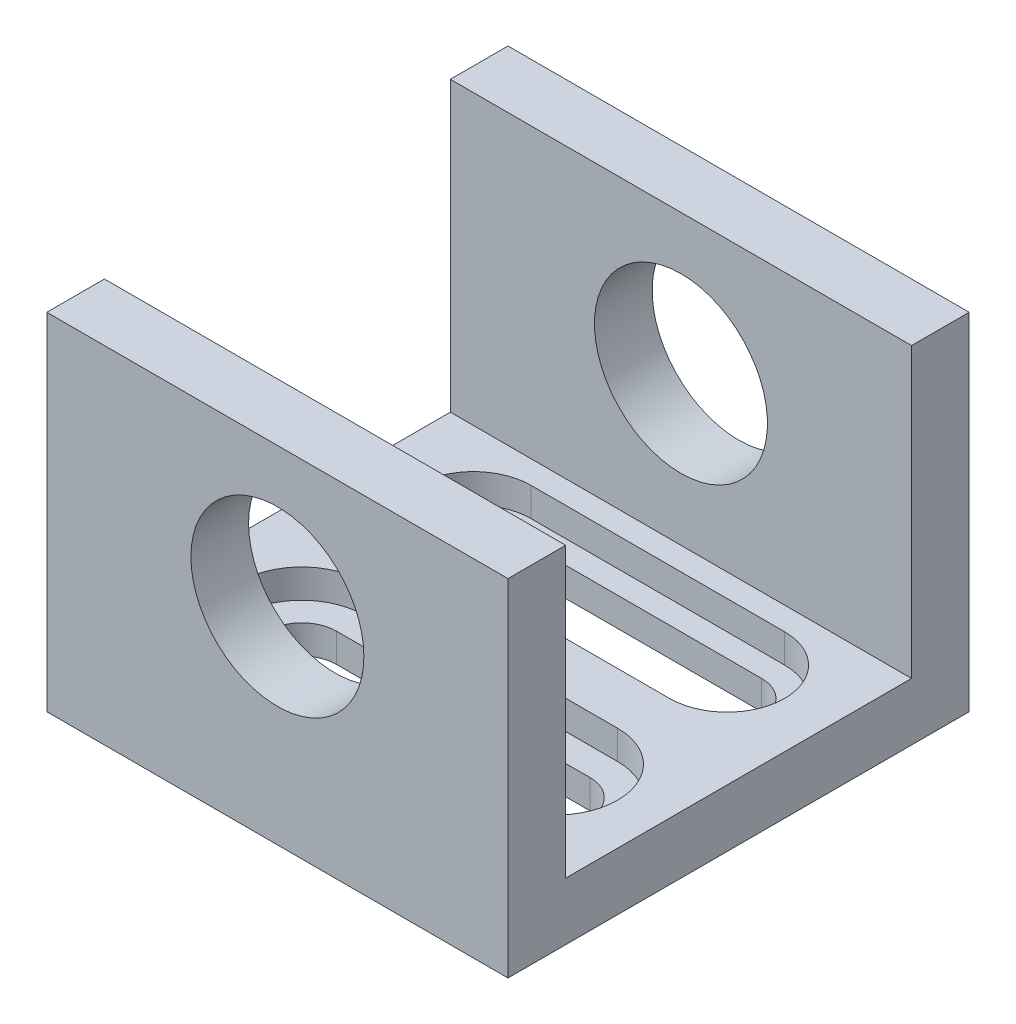
from build123d import *

# Parameters (mm, degrees)
BOSS_EXTRUDE2_DEPTH = 25.4
SKETCH3_R           = 4.7625
CUT_EXTRUDE1_DEPTH  = 36.576
CUT_EXTRUDE2_DEPTH  = 66.04
CUT_EXTRUDE3_DEPTH  = 1.5875
CUT_EXTRUDE4_DEPTH  = 1.5875
CUT_EXTRUDE5_DEPTH  = 45.510676996


with BuildPart() as part:
    # Sketch1 → Boss-Extrude2 (new body)
    with BuildSketch(Plane(origin=(-35.145897579, 0, 0), x_dir=(0, 0, -1), z_dir=(1, 0, 0))):
        Polygon((0, 0), (-19.05, 0), (-22.225, 0), (-22.225, 19.05), (-19.05, 19.05), (-19.05, 3.175), (0, 3.175), (0, 19.05), (3.175, 19.05), (3.175, 0), align=None)
    extrude(amount=BOSS_EXTRUDE2_DEPTH)

    # Sketch3 → Cut-Extrude1 (cut)
    with BuildSketch(Plane(origin=(0, 0, -3.175), x_dir=(-1, 0, 0), z_dir=(0, 0, -1))):
        with Locations((22.445897579, 11.3665)):
            Circle(SKETCH3_R)
    extrude(amount=-CUT_EXTRUDE1_DEPTH, mode=Mode.SUBTRACT)

    # Sketch4 → Cut-Extrude2 (cut)
    with BuildSketch(Plane(origin=(0, 3.175, 0), x_dir=(1, 0, 0), z_dir=(0, 1, 0))):
        with BuildLine():
            Line((-29.430897579, -2.54), (-15.460897579, -2.54))
            ThreePointArc((-15.460897579, -2.54), (-13.555897579, -4.445), (-15.460897579, -6.35))
            Line((-15.460897579, -6.35), (-29.430897579, -6.35))
            ThreePointArc((-29.430897579, -6.35), (-31.335897579, -4.445), (-29.430897579, -2.54))
        make_face()
    extrude(amount=-CUT_EXTRUDE2_DEPTH, mode=Mode.SUBTRACT)

    # Sketch7 → Cut-Extrude3 (cut)
    with BuildSketch(Plane(origin=(0, 3.175, 0), x_dir=(1, 0, 0), z_dir=(0, 1, 0))):
        with BuildLine():
            Line((-29.430897579, -1.27), (-15.460897579, -1.27))
            ThreePointArc((-15.460897579, -1.27), (-12.285897579, -4.445), (-15.460897579, -7.62))
            Line((-15.460897579, -7.62), (-29.430897579, -7.62))
            ThreePointArc((-29.430897579, -7.62), (-32.605897579, -4.445), (-29.430897579, -1.27))
        make_face()
    extrude(amount=-CUT_EXTRUDE3_DEPTH, mode=Mode.SUBTRACT)

    # Sketch8 → Cut-Extrude4 (cut)
    with BuildSketch(Plane(origin=(0, 3.175, 0), x_dir=(1, 0, 0), z_dir=(0, 1, 0))):
        with BuildLine():
            Line((-15.460897579, -10.469840803), (-29.430897579, -10.469840803))
            ThreePointArc((-29.430897579, -10.469840803), (-32.859897579, -13.898840803), (-29.430897579, -17.327840803))
            Line((-29.430897579, -17.327840803), (-15.460897579, -17.327840803))
            ThreePointArc((-15.460897579, -17.327840803), (-12.031897579, -13.898840803), (-15.460897579, -10.469840803))
        make_face()
    extrude(amount=-CUT_EXTRUDE4_DEPTH, mode=Mode.SUBTRACT)

    # Sketch8<3> → Cut-Extrude5 (cut, through all)
    with BuildSketch(Plane(origin=(0, 3.175, 0), x_dir=(1, 0, 0), z_dir=(0, 1, 0))):
        with BuildLine():
            Line((-15.460897579, -11.993840803), (-29.430897579, -11.993840803))
            ThreePointArc((-29.430897579, -11.993840803), (-31.335897579, -13.898840803), (-29.430897579, -15.803840803))
            Line((-29.430897579, -15.803840803), (-15.460897579, -15.803840803))
            ThreePointArc((-15.460897579, -15.803840803), (-13.555897579, -13.898840803), (-15.460897579, -11.993840803))
        make_face()
    extrude(amount=-CUT_EXTRUDE5_DEPTH, mode=Mode.SUBTRACT)


solid = part.part
